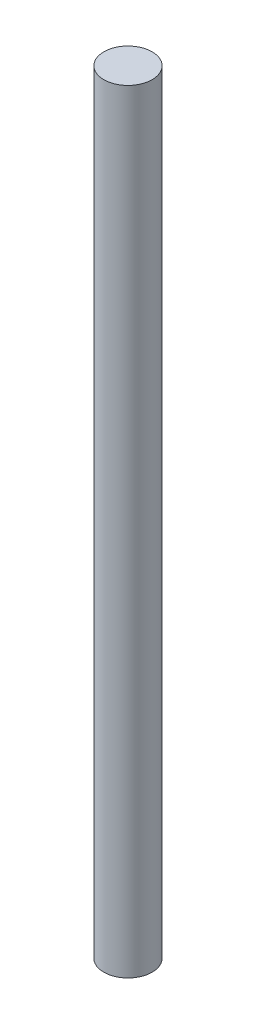
from build123d import *

# Parameters (mm, degrees)
SKETCH1_R           = 1.5
BOSS_EXTRUDE1_DEPTH = 48


with BuildPart() as part:
    # Sketch1 → Boss-Extrude1 (new body)
    with BuildSketch(Plane(origin=(0, 0, 0), x_dir=(1, 0, 0), z_dir=(0, 1, 0))):
        with Locations(Location((0, 0, 0), (0, 0, 270))):
            Circle(SKETCH1_R)
    extrude(amount=BOSS_EXTRUDE1_DEPTH)


solid = part.part
